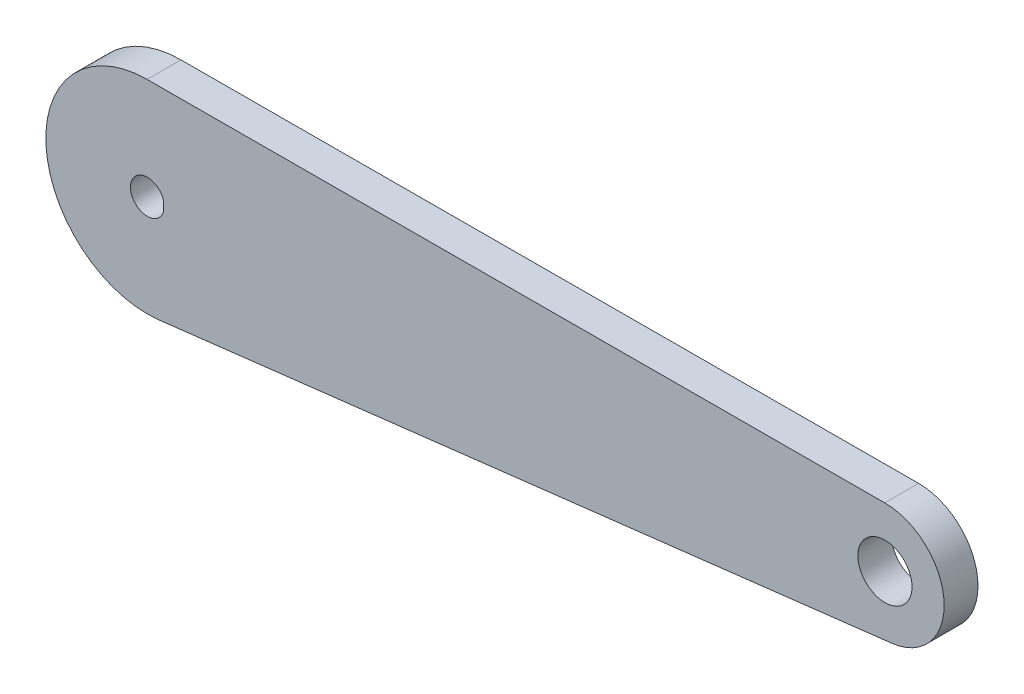
from build123d import *

# Parameters (mm, degrees)
SKETCH_2_R          = 15
SKETCH_2_R_2        = 8.75
EXTRUDE_1_DEPTH     = 5
SKETCH_3_R          = 4
CUT_EXTRUDE_1_DEPTH = 5


with BuildPart() as part:
    # 草图2 → 凸台-拉伸1 (new body)
    with BuildSketch(Plane.XY):
        Circle(SKETCH_2_R)
        with BuildLine():
            Line((108.957293046, 15.310277664), (-0.042706954, 14.999939204))
            ThreePointArc((-0.042706954, 14.999939204), (10.591491767, 10.621690174), (15, 0))
            ThreePointArc((15, 0), (11.210584144, -9.966082639), (1.756959578, -14.896747734))
            Line((1.756959578, -14.896747734), (110.007098523, -2.129456383))
            ThreePointArc((110.007098523, -2.129456383), (100.248015648, 6.034548214), (108.957293046, 15.310277664))
        make_face()
        with Locations((108.982205436, 6.560313128)):
            Circle(SKETCH_2_R_2)
    extrude(amount=EXTRUDE_1_DEPTH)

    # 草图3 → 切除-拉伸1 (cut)
    with BuildSketch(Plane.XY.offset(5)):
        with BuildLine():
            Line((2.4, -0.7), (2.4, 0))
            Line((2.4, 0), (2.4, 0.7))
            ThreePointArc((2.4, 0.7), (-2.5, 0), (2.4, -0.7))
        make_face()
        with Locations((108.982205436, 6.560313128)):
            Circle(SKETCH_3_R)
    extrude(amount=-CUT_EXTRUDE_1_DEPTH, mode=Mode.SUBTRACT)


solid = part.part
